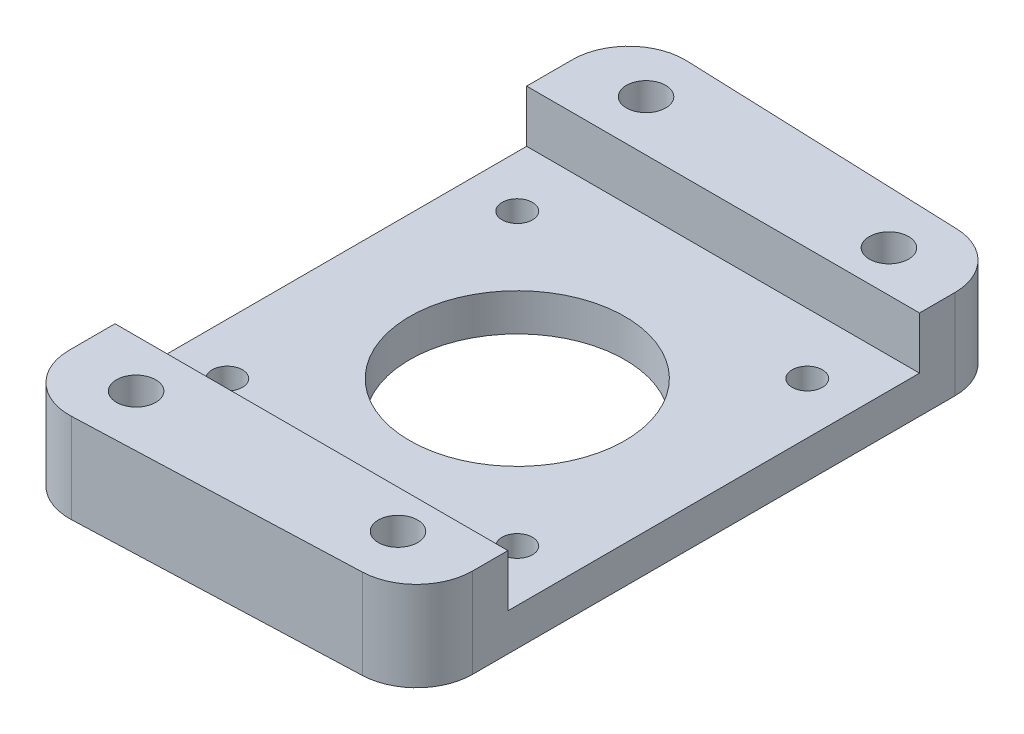
from build123d import *

# Parameters (mm, degrees)
BOSS_EXTRUDE1_DEPTH = 4
SKETCH3_R           = 11.5
CUT_EXTRUDE1_DEPTH  = 40.430297181
SKETCH4_R           = 1.625
CUT_EXTRUDE2_DEPTH  = 40.430297181
BOSS_EXTRUDE2_DEPTH = 5.575
SKETCH7_R           = 2.1
CUT_EXTRUDE3_DEPTH  = 6
FILLET1_R           = 6


with BuildPart() as part:
    # Sketch1 → Boss-Extrude1 (new body)
    with BuildSketch(Plane(origin=(0, 0, 0), x_dir=(1, 0, 0), z_dir=(0, 1, 0))):
        Polygon((-21, -33.132285399), (21, -31.552085087), (21, 31.552085087), (-21, 33.132285399), align=None)
    extrude(amount=BOSS_EXTRUDE1_DEPTH)

    # Sketch3 → Cut-Extrude1 (cut, through all)
    with BuildSketch(Plane(origin=(0, 4, 0), x_dir=(1, 0, 0), z_dir=(0, 1, 0))):
        with Locations(Location((0, 0, 0), (0, 0, 270))):
            Circle(SKETCH3_R)
    extrude(amount=-CUT_EXTRUDE1_DEPTH, mode=Mode.SUBTRACT)

    # Sketch4 → Cut-Extrude2 (cut, through all)
    with BuildSketch(Plane(origin=(0, 4, 0), x_dir=(1, 0, 0), z_dir=(0, 1, 0))):
        with Locations(Location((-15.5, 15.5, 0), (0, 0, 270))):
            Circle(SKETCH4_R)
        with Locations(Location((15.5, 15.5, 0), (0, 0, 270))):
            Circle(SKETCH4_R)
        with Locations(Location((15.5, -15.5, 0), (0, 0, 270))):
            Circle(SKETCH4_R)
        with Locations(Location((-15.5, -15.5, 0), (0, 0, 270))):
            Circle(SKETCH4_R)
    extrude(amount=-CUT_EXTRUDE2_DEPTH, mode=Mode.SUBTRACT)

    # Sketch6 → Boss-Extrude2 (add)
    with BuildSketch(Plane.XZ.offset(-4)):
        Polygon((21, 22), (-21, 22), (-21, 33.132285399), (21, 31.552085087), align=None)
    boss_extrude2 = extrude(amount=-BOSS_EXTRUDE2_DEPTH)

    # Mirror1: Boss-Extrude2 across plane
    add(boss_extrude2.mirror(Plane.XY))

    # Sketch7 → Cut-Extrude3 (cut)
    with BuildSketch(Plane(origin=(0, 9.575, 0), x_dir=(1, 0, 0), z_dir=(0, 1, 0))):
        with Locations(Location((-13.640455159, -27.106476824, 0), (0, 0, 270))):
            Circle(SKETCH7_R)
        with Locations(Location((13.340455159, -26.091351992, 0), (0, 0, 270))):
            Circle(SKETCH7_R)
        with Locations(Location((13.340455159, 26.391351992, 0), (0, 0, 270))):
            Circle(SKETCH7_R)
        with Locations(Location((-13.640455159, 27.406476824, 0), (0, 0, 270))):
            Circle(SKETCH7_R)
    extrude(amount=-CUT_EXTRUDE3_DEPTH, mode=Mode.SUBTRACT)

    # Fillet1
    fillet1_edges = [part.edges().sort_by_distance(p)[0] for p in [
        (-21, 4.7875, -33.132285399),
        (21, 4.7875, -31.552085087),
        (21, 4.7875, 31.552085087),
        (-21, 4.7875, 33.132285399),
    ]]
    fillet(fillet1_edges, radius=FILLET1_R)


solid = part.part
